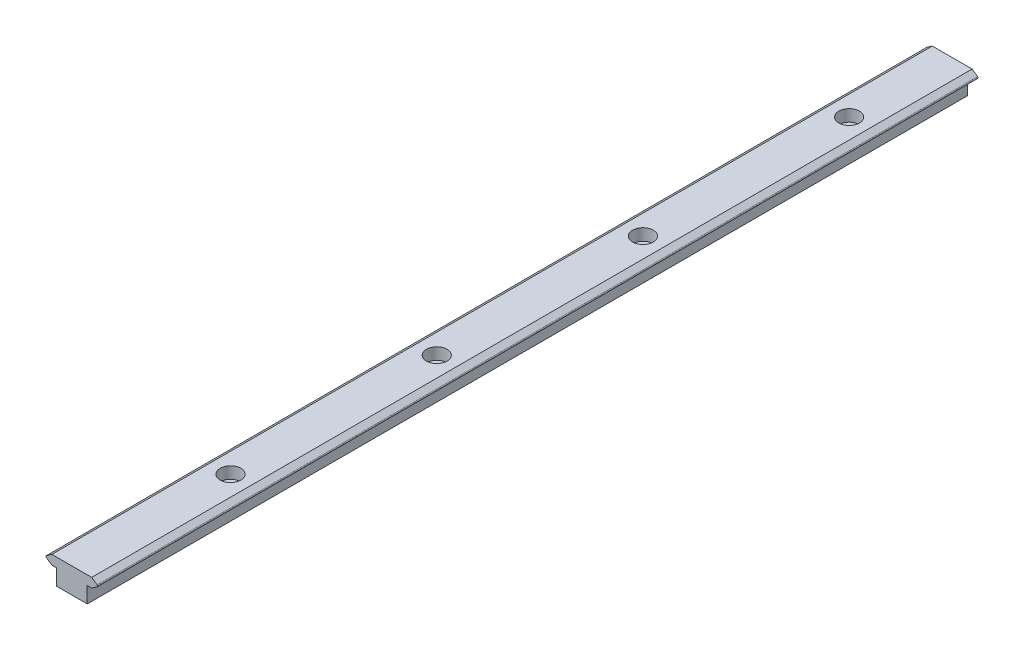
from build123d import *

# Parameters (mm, degrees)
SKETCH_2_R                   = 183
EXTRUDE_1_DEPTH              = 7.75
HOLE_WIZARD_M5_1_D           = 5.5
HOLE_WIZARD_M5_1_CBORE_D     = 9
HOLE_WIZARD_M5_1_CBORE_DEPTH = 6
SKETCH_6_W                   = 499.91157149
SKETCH_6_H                   = 215.35218654
CUT_EXTRUDE_1_DEPTH          = 267.151754372
EXTRUDE_2_DEPTH              = 427
SKETCH_8_W                   = 538.874028387
SKETCH_8_H                   = 388.77669628
CUT_EXTRUDE_2_DEPTH          = 467.660847956
HOLE_WIZARD_1_D              = 5.5
HOLE_WIZARD_1_CBORE_D        = 10
HOLE_WIZARD_1_CBORE_DEPTH    = 5.7


with BuildPart() as part:
    # 草图1 → 旋转1 (revolve)
    with BuildSketch(Plane.XY, mode=Mode.PRIVATE) as revolve_1_sk:
        with BuildLine():
            Line((185.156666985, 2.25), (0, 2.25))
            Line((0, 2.25), (0, -2.25))
            Line((0, -2.25), (185.156666985, -2.25))
            Line((185.156666985, -2.25), (187.78506482, -0.409576022))
            add(Edge.make_bspline(
                [(187.78506482, 0.409576022), (187.830906121, 0.377477598), (187.871837762, 0.337021948), (187.904470176, 0.291559224), (187.937102589, 0.246096499), (187.962335818, 0.194372782), (187.978080287, 0.140671335), (187.993824756, 0.086969887), (188.000514717, 0.029809558), (187.997596172, -0.026076181), (187.994677627, -0.08196192), (187.982070079, -0.138114466), (187.960817564, -0.189883804), (187.939565048, -0.241653142), (187.909081396, -0.290467133), (187.87189097, -0.332283469), (187.846140091, -0.361237358), (187.816805619, -0.387350876), (187.78506482, -0.409576022)],
                knots=[0, 0, 0, 0, 0.000167886, 0.000167886, 0.000167886, 0.000335771, 0.000335771, 0.000335771, 0.000503657, 0.000503657, 0.000503657, 0.000671543, 0.000671543, 0.000671543, 0.000839428, 0.000839428, 0.000839428, 0.000954806, 0.000954806, 0.000954806, 0.000954806], degree=3))
            Line((187.78506482, 0.409576022), (185.156666985, 2.25))
        make_face()
    revolve(revolve_1_sk.sketch.rotate(Axis((0, 2.25, 0), (0, -1, 0)), 270), axis=Axis((0, 2.25, 0), (0, -1, 0)))

    # 草图2 → 凸台-拉伸1 (add)
    with BuildSketch(Plane.XZ.offset(2.25)):
        with Locations(Location((0, 0, 0), (0, 0, 270))):
            Circle(SKETCH_2_R)
    extrude(amount=EXTRUDE_1_DEPTH)

    # 草图3 → 切除-旋转1 (revolve, cut)
    with BuildSketch(Plane.XY, mode=Mode.PRIVATE) as cut_revolve_1_sk:
        with BuildLine():
            Line((165.843333015, 2.25), (0, 2.25))
            Line((0, 2.25), (0, -10))
            Line((0, -10), (168, -10))
            Line((168, -10), (168, -2.25))
            Line((168, -2.25), (165.843333015, -2.25))
            Line((165.843333015, -2.25), (163.21493518, -0.409576022))
            ThreePointArc((163.21493518, -0.409576022), (163.001723398, 0), (163.21493518, 0.409576022))
            Line((163.21493518, 0.409576022), (165.843333015, 2.25))
        make_face()
    revolve(cut_revolve_1_sk.sketch.rotate(Axis((0, 2.25, 0), (0, -1, 0)), 270), axis=Axis((0, 2.25, 0), (0, -1, 0)), mode=Mode.SUBTRACT)

    # M5 六角头螺栓的柱形沉头孔1 (through all)
    with Locations(Plane(origin=(0, 2.25, 0), x_dir=(1, 0, 0), z_dir=(0, 1, 0))):
        with Locations((-45.422742415, -169.519982514), (-124.097240098, -124.097240098), (-169.519982514, -45.422742415), (45.422742415, -169.519982514), (124.097240098, -124.097240098), (169.519982514, -45.422742415), (-45.422742415, 169.519982514), (-124.097240098, 124.097240098), (-169.519982514, 45.422742415), (45.422742415, 169.519982514), (124.097240098, 124.097240098), (169.519982514, 45.422742415)):
            CounterBoreHole(HOLE_WIZARD_M5_1_D / 2, HOLE_WIZARD_M5_1_CBORE_D / 2, HOLE_WIZARD_M5_1_CBORE_DEPTH)

    # 草图6 → 切除-拉伸1 (cut, through all)
    with BuildSketch(Plane(origin=(0, 2.25, 0), x_dir=(1, 0, 0), z_dir=(0, 1, 0))):
        with Locations((-5.153727541, -107.67609327)):
            Rectangle(SKETCH_6_W, SKETCH_6_H)
    extrude(amount=-CUT_EXTRUDE_1_DEPTH, mode=Mode.SUBTRACT)

    # 草图7 → 凸台-拉伸2 (add)
    with BuildSketch(Plane.XY):
        with BuildLine():
            Line((-185.156666985, 2.25), (-187.78506482, 0.409576022))
            add(Edge.make_bspline(
                [(-187.78506482, 0.409576022), (-187.830906121, 0.377477598), (-187.871837762, 0.337021948), (-187.904470176, 0.291559224), (-187.937102589, 0.246096499), (-187.962335818, 0.194372782), (-187.978080287, 0.140671335), (-187.993824756, 0.086969887), (-188.000514717, 0.029809558), (-187.997596172, -0.026076181), (-187.994677627, -0.08196192), (-187.982070079, -0.138114466), (-187.960817564, -0.189883804), (-187.939565048, -0.241653142), (-187.909081396, -0.290467133), (-187.87189097, -0.332283469), (-187.846140091, -0.361237358), (-187.816805619, -0.387350876), (-187.78506482, -0.409576022)],
                knots=[0, 0, 0, 0, 0.000167886, 0.000167886, 0.000167886, 0.000335771, 0.000335771, 0.000335771, 0.000503657, 0.000503657, 0.000503657, 0.000671543, 0.000671543, 0.000671543, 0.000839428, 0.000839428, 0.000839428, 0.000954806, 0.000954806, 0.000954806, 0.000954806], degree=3))
            Line((-187.78506482, -0.409576022), (-185.156666985, -2.25))
            Line((-185.156666985, -2.25), (-183, -2.25))
            Line((-183, -2.25), (-183, -10))
            Line((-183, -10), (-168, -10))
            Line((-168, -10), (-168, -2.25))
            Line((-168, -2.25), (-165.843333015, -2.25))
            Line((-165.843333015, -2.25), (-163.21493518, -0.409576022))
            ThreePointArc((-163.21493518, -0.409576022), (-163.001723398, 0), (-163.21493518, 0.409576022))
            Line((-163.21493518, 0.409576022), (-165.843333015, 2.25))
            Line((-165.843333015, 2.25), (-185.156666985, 2.25))
        make_face()
    extrude(amount=EXTRUDE_2_DEPTH)

    # 草图8 → 切除-拉伸2 (cut, through all)
    with BuildSketch(Plane.XY):
        with Locations((39.369792029, -22.329590013)):
            Rectangle(SKETCH_8_W, SKETCH_8_H)
    extrude(amount=-CUT_EXTRUDE_2_DEPTH, mode=Mode.SUBTRACT)

    # 打孔尺寸(%根据)内六角圆柱头螺钉的类型1 (through all)
    with Locations(Plane(origin=(0, 2.25, 0), x_dir=(1, 0, 0), z_dir=(0, 1, 0))):
        with Locations((-175.5, -50), (-175.5, -450), (-175.5, -150), (-175.5, -350), (-175.5, -250)):
            CounterBoreHole(HOLE_WIZARD_1_D / 2, HOLE_WIZARD_1_CBORE_D / 2, HOLE_WIZARD_1_CBORE_DEPTH)


solid = part.part
